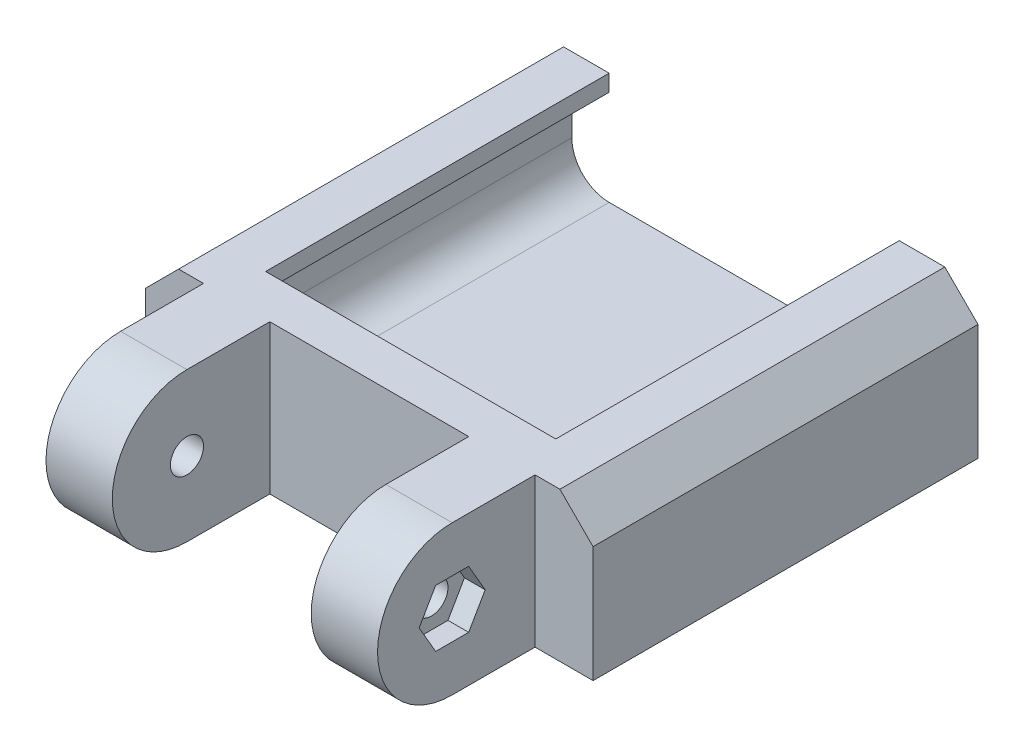
from build123d import *

# Parameters (mm, degrees)
SKETCH1_W                     = 56
SKETCH1_H                     = 45
BOSS_EXTRUDE1_DEPTH           = 5
BOSS_EXTRUDE2_DEPTH           = 5
SKETCH3_W                     = 56
SKETCH3_H                     = 8.40027106
CUT_EXTRUDE1_DEPTH            = 0.5
BOSS_EXTRUDE3_DEPTH           = 3.5
SKETCH5_W                     = 5
SKETCH5_H                     = 3.247037966
CUT_EXTRUDE2_DEPTH            = 3.5
BOSS_EXTRUDE4_DEPTH           = 16.416410101
BOSS_EXTRUDE5_DEPTH           = 54
CHAMFER1_SIZE                 = 4
CSK_FOR_M4_SFHCS1_D           = 4
CSK_FOR_M4_SFHCS1_DEPTH       = 5
CSK_FOR_M4_SFHCS1_CSINK_D     = 7.6
CSK_FOR_M4_SFHCS1_CSINK_ANGLE = 90
CUT_EXTRUDE3_DEPTH            = 80.660134165
CUT_EXTRUDE3_DEPTH_BACK       = 80.660134165
SKETCH11_W                    = 8
SKETCH11_H                    = 16.218738619
FILLET1_R                     = 4.5
CUT_EXTRUDE4_START            = 18
CUT_EXTRUDE4_DEPTH            = 18
BOSS_EXTRUDE6_DEPTH           = 18
BOSS_EXTRUDE7_START           = -90
BOSS_EXTRUDE7_DEPTH           = 18
SKETCH16_W                    = 118.653956423
SKETCH16_H                    = 92.574487852
CUT_EXTRUDE5_DEPTH            = 39
SKETCH17_W                    = 131.858911514
SKETCH17_H                    = 83.404733186
CUT_EXTRUDE6_DEPTH            = 86
SKETCH18_W                    = 99.193977615
SKETCH18_H                    = 87.816890576
CUT_EXTRUDE7_DEPTH            = 109
SKETCH19_W                    = 81.935577426
SKETCH19_H                    = 38.938723706
CUT_EXTRUDE8_DEPTH            = 24.977359313
BOSS_EXTRUDE8_START           = 10
BOSS_EXTRUDE8_DEPTH           = 10
BOSS_EXTRUDE9_DEPTH           = 5
SKETCH22_W                    = 8
SKETCH22_H                    = 18
BOSS_EXTRUDE10_DEPTH          = 10
BOSS_EXTRUDE11_START          = -8
BOSS_EXTRUDE11_DEPTH          = 8
BOSS_EXTRUDE12_START          = -40
BOSS_EXTRUDE12_DEPTH          = 8
CSK_FOR_M4_SFHCS2_D           = 4
CSK_FOR_M4_SFHCS2_DEPTH       = 40
CSK_FOR_M4_SFHCS2_CSINK_D     = 7.5
CSK_FOR_M4_SFHCS2_CSINK_ANGLE = 90
CSK_FOR_M4_SFHCS2_TIP         = 1.201721238
CUT_EXTRUDE9_DEPTH            = 2.5


with BuildPart() as part:
    # Sketch1 → Boss-Extrude1 (new body)
    with BuildSketch(Plane(origin=(0, 0, 0), x_dir=(1, 0, 0), z_dir=(0, 1, 0))):
        Rectangle(SKETCH1_W, SKETCH1_H)
    extrude(amount=BOSS_EXTRUDE1_DEPTH)

    # Sketch2 → Boss-Extrude2 (add)
    with BuildSketch(Plane.XZ):
        Polygon((-45, -6.940200144), (-24, 6.697359313), (24, 6.697359313), (45, -6.940200144), (45, 3.059799856), (28, 14.09972894), (-28, 14.09972894), (-45, 3.059799856), align=None)
    extrude(amount=BOSS_EXTRUDE2_DEPTH)

    # Sketch3 → Cut-Extrude1 (cut)
    with BuildSketch(Plane.XZ):
        with Locations((0, 18.29986447)):
            Rectangle(SKETCH3_W, SKETCH3_H)
    extrude(amount=-CUT_EXTRUDE1_DEPTH, mode=Mode.SUBTRACT)

    # Sketch4 → Boss-Extrude3 (add)
    with BuildSketch(Plane(origin=(0, 0, 0), x_dir=(1, 0, 0), z_dir=(0, 1, 0))):
        Polygon((28, -40.539929084), (28, 22.5), (45, 22.5), (45, -29.5), align=None)
        Polygon((-28, -4.09972894), (-28, 22.5), (-45, 22.5), (-45, 6.940200144), align=None)
        Polygon((-28, -40.539929084), (-28, -14.09972894), (-45, -3.059799856), (-45, -29.5), align=None)
        Polygon((-45, -3.059799856), (-28, -14.09972894), (-28, -4.09972894), (-45, 6.940200144), align=None)
    extrude(amount=BOSS_EXTRUDE3_DEPTH)

    # Sketch5 → Cut-Extrude2 (cut)
    with BuildSketch(Plane(origin=(0, 3.5, 0), x_dir=(1, 0, 0), z_dir=(0, 1, 0))):
        with Locations((-28, -40.539929084)):
            Rectangle(SKETCH5_W, SKETCH5_H)
        with Locations((28, -40.539929084)):
            Rectangle(SKETCH5_W, SKETCH5_H)
    extrude(amount=-CUT_EXTRUDE2_DEPTH, mode=Mode.SUBTRACT)

    # Sketch6 → Boss-Extrude4 (add)
    with BuildSketch(Plane.XY.offset(22.5)):
        Polygon((-28, 0.5), (28, 0.5), (28, 3.5), (28, 5), (-28, 5), (-28, 3.5), align=None)
    extrude(amount=BOSS_EXTRUDE4_DEPTH)

    # Sketch8 → Boss-Extrude5 (add)
    with BuildSketch(Plane.XY.offset(38.916410101)):
        Polygon((-22, 5), (-22, 16.5), (-17.5, 16.5), (-17.5, 18.5), (-27, 18.5), (-27, 16.5), (-27, 5), align=None)
        Polygon((27, 5), (27, 16.5), (27, 18.5), (17.5, 18.5), (17.5, 16.5), (22, 16.5), (22, 5), align=None)
    extrude(amount=-BOSS_EXTRUDE5_DEPTH)

    # Chamfer1
    chamfer1_edges = [part.edges().sort_by_distance(p)[0] for p in [
        (-27, 18.5, 11.916410101),
        (27, 18.5, 11.916410101),
    ]]
    chamfer(chamfer1_edges, length=CHAMFER1_SIZE)

    # CSK for M4 SFHCS1
    with Locations(Plane(origin=(0, 5, 0), x_dir=(1, 0, 0), z_dir=(0, 1, 0))):
        with Locations((-17, 1.522640687), (17, 1.522640687)):
            CounterSinkHole(CSK_FOR_M4_SFHCS1_D / 2, CSK_FOR_M4_SFHCS1_CSINK_D / 2, depth=CSK_FOR_M4_SFHCS1_DEPTH, counter_sink_angle=CSK_FOR_M4_SFHCS1_CSINK_ANGLE)

    # Sketch11 → Cut-Extrude3 (cut, two sides: drawn at the far end of the back side and taken through both)
    with BuildSketch(Plane.ZY.offset(-22).offset(-CUT_EXTRUDE3_DEPTH_BACK)):
        with Locations((-1.522640687, 13.109369309)):
            Rectangle(SKETCH11_W, SKETCH11_H)
    extrude(amount=CUT_EXTRUDE3_DEPTH + CUT_EXTRUDE3_DEPTH_BACK, mode=Mode.SUBTRACT)

    # Fillet1
    fillet1_edges = [part.edges().sort_by_distance(p)[0] for p in [
        (-22, 5, -10.303115293),
        (22, 5, -10.303115293),
        (-22, 5, 20.696884707),
        (22, 5, 20.696884707),
    ]]
    fillet(fillet1_edges, radius=FILLET1_R)

    # Sketch14 → Cut-Extrude4 (cut)
    with BuildSketch(Plane(origin=(0, 0, 2.477359313), x_dir=(-1, 0, 0), z_dir=(0, 0, -1)).offset(CUT_EXTRUDE4_START)):
        with BuildLine():
            Line((-27, 5), (-17.5, 5))
            ThreePointArc((-17.5, 5), (-20.681980515, 6.318019485), (-22, 9.5))
            Line((-22, 9.5), (-22, 16.5))
            Line((-22, 16.5), (-17.5, 16.5))
            Line((-17.5, 16.5), (-17.5, 18.5))
            Line((-17.5, 18.5), (-23, 18.5))
            Line((-23, 18.5), (-27, 14.5))
            Line((-27, 14.5), (-27, 5))
        make_face()
        with BuildLine():
            Line((22, 16.5), (22, 9.5))
            ThreePointArc((22, 9.5), (20.681980515, 6.318019485), (17.5, 5))
            Line((17.5, 5), (27, 5))
            Line((27, 5), (27, 14.5))
            Line((27, 14.5), (23, 18.5))
            Line((23, 18.5), (17.5, 18.5))
            Line((17.5, 18.5), (17.5, 16.5))
            Line((17.5, 16.5), (22, 16.5))
        make_face()
    extrude(amount=-CUT_EXTRUDE4_DEPTH, mode=Mode.SUBTRACT)

    # Sketch15 → Boss-Extrude6 (add)
    with BuildSketch(Plane.ZY.offset(45)):
        Polygon((29.5, 3.5), (49.5, 3.5), (60.311407923, -47.363675238), (55.199704948, -47.363675238), (45.132244992, 0), (29.5, 0), align=None)
    extrude(amount=-BOSS_EXTRUDE6_DEPTH)

    # Sketch15<3> → Boss-Extrude7 (add)
    with BuildSketch(Plane.ZY.offset(45).offset(BOSS_EXTRUDE7_START)):
        Polygon((29.5, 3.5), (49.5, 3.5), (60.311407923, -47.363675238), (55.199704948, -47.363675238), (45.132244992, 0), (29.5, 0), align=None)
    extrude(amount=BOSS_EXTRUDE7_DEPTH)

    # Sketch16 → Cut-Extrude5 (cut)
    with BuildSketch(Plane.ZY.offset(27)):
        with Locations((22.108445716, -11.305351621)):
            Rectangle(SKETCH16_W, SKETCH16_H)
    extrude(amount=CUT_EXTRUDE5_DEPTH, mode=Mode.SUBTRACT)

    # Sketch17 → Cut-Extrude6 (cut)
    with BuildSketch(Plane(origin=(27, 0, 0), x_dir=(0, 0, -1), z_dir=(1, 0, 0))):
        with Locations((-19.541168595, -14.670136857)):
            Rectangle(SKETCH17_W, SKETCH17_H)
    extrude(amount=CUT_EXTRUDE6_DEPTH, mode=Mode.SUBTRACT)

    # Sketch18 → Cut-Extrude7 (cut)
    with BuildSketch(Plane.XZ.offset(-0.5)):
        with Locations((2.429482128, 7.437881449)):
            Rectangle(SKETCH18_W, SKETCH18_H)
    extrude(amount=CUT_EXTRUDE7_DEPTH, mode=Mode.SUBTRACT)

    # Sketch19 → Cut-Extrude8 (cut)
    with BuildSketch(Plane(origin=(0, 0, -22.5), x_dir=(-1, 0, 0), z_dir=(0, 0, -1))):
        with Locations((6.570305737, 10.128043931)):
            Rectangle(SKETCH19_W, SKETCH19_H)
    extrude(amount=-CUT_EXTRUDE8_DEPTH, mode=Mode.SUBTRACT)

    # Sketch20 → Boss-Extrude8 (add)
    with BuildSketch(Plane(origin=(0, 0, 2.477359313), x_dir=(-1, 0, 0), z_dir=(0, 0, -1)).offset(BOSS_EXTRUDE8_START)):
        with BuildLine():
            Line((-27, 14.5), (-27, 0.5))
            Line((-27, 0.5), (27, 0.5))
            Line((27, 0.5), (27, 14.5))
            Line((27, 14.5), (23, 18.5))
            Line((23, 18.5), (17.5, 18.5))
            Line((17.5, 18.5), (17.5, 16.5))
            Line((17.5, 16.5), (22, 16.5))
            Line((22, 16.5), (22, 9.5))
            ThreePointArc((22, 9.5), (20.681980515, 6.318019485), (17.5, 5))
            Line((17.5, 5), (-17.5, 5))
            ThreePointArc((-17.5, 5), (-20.681980515, 6.318019485), (-22, 9.5))
            Line((-22, 9.5), (-22, 16.5))
            Line((-22, 16.5), (-17.5, 16.5))
            Line((-17.5, 16.5), (-17.5, 18.5))
            Line((-17.5, 18.5), (-23, 18.5))
            Line((-23, 18.5), (-27, 14.5))
        make_face()
    extrude(amount=-BOSS_EXTRUDE8_DEPTH)

    # Sketch21 → Boss-Extrude9 (add)
    with BuildSketch(Plane.XY.offset(38.916410101)):
        Polygon((17.5, 18.5), (-17.5, 18.5), (-23, 18.5), (-27, 14.5), (-27, 0.5), (27, 0.5), (27, 14.5), (23, 18.5), align=None)
    extrude(amount=-BOSS_EXTRUDE9_DEPTH)

    # Sketch22 → Boss-Extrude10 (add)
    with BuildSketch(Plane.XY.offset(38.916410101)):
        with Locations((-16, 9.5)):
            Rectangle(SKETCH22_W, SKETCH22_H)
        with Locations((16, 9.5)):
            Rectangle(SKETCH22_W, SKETCH22_H)
    extrude(amount=BOSS_EXTRUDE10_DEPTH)

    # Sketch23 → Boss-Extrude11 (add)
    with BuildSketch(Plane(origin=(20, 0, 0), x_dir=(0, 0, -1), z_dir=(1, 0, 0)).offset(BOSS_EXTRUDE11_START)):
        with BuildLine():
            Line((-48.916410101, 18.5), (-48.916410101, 0.5))
            ThreePointArc((-48.916410101, 0.5), (-57.916410101, 9.5), (-48.916410101, 18.5))
        make_face()
    extrude(amount=BOSS_EXTRUDE11_DEPTH)

    # Sketch23<2> → Boss-Extrude12 (add)
    with BuildSketch(Plane(origin=(20, 0, 0), x_dir=(0, 0, -1), z_dir=(1, 0, 0)).offset(BOSS_EXTRUDE12_START)):
        with BuildLine():
            Line((-48.916410101, 18.5), (-48.916410101, 0.5))
            ThreePointArc((-48.916410101, 0.5), (-57.916410101, 9.5), (-48.916410101, 18.5))
        make_face()
    extrude(amount=BOSS_EXTRUDE12_DEPTH)

    # CSK for M4 SFHCS2
    with Locations(Plane.ZY.offset(20)):
        with Locations((48.916410101, 9.5)):
            CounterSinkHole(CSK_FOR_M4_SFHCS2_D / 2, CSK_FOR_M4_SFHCS2_CSINK_D / 2, depth=CSK_FOR_M4_SFHCS2_DEPTH, counter_sink_angle=CSK_FOR_M4_SFHCS2_CSINK_ANGLE)
            with Locations((0, 0, -(CSK_FOR_M4_SFHCS2_DEPTH + CSK_FOR_M4_SFHCS2_TIP / 2))):  # 118° drill point
                Cone(0, CSK_FOR_M4_SFHCS2_D / 2, CSK_FOR_M4_SFHCS2_TIP, mode=Mode.SUBTRACT)

    # Sketch27 → Cut-Extrude9 (cut)
    with BuildSketch(Plane(origin=(20, 0, 0), x_dir=(0, 0, -1), z_dir=(1, 0, 0))):
        Polygon((-44.932693244, 9.5), (-46.924551673, 12.95), (-50.90826853, 12.95), (-52.900126959, 9.5), (-50.90826853, 6.05), (-46.924551673, 6.05), align=None)
    extrude(amount=-CUT_EXTRUDE9_DEPTH, mode=Mode.SUBTRACT)


solid = part.part
